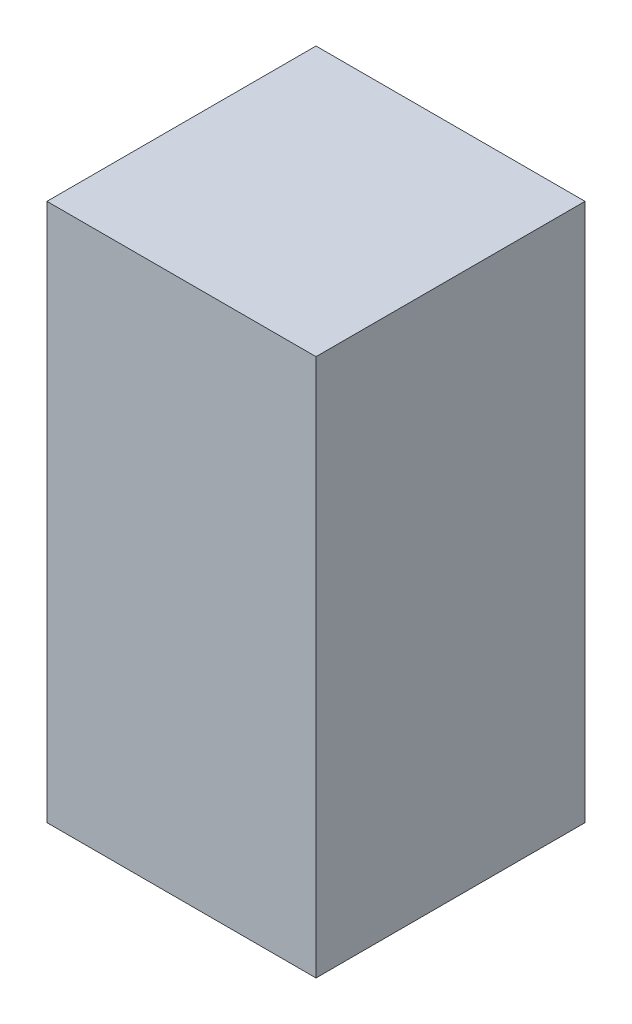
from build123d import *

# Parameters (mm, degrees)
SKETCH1_W           = 127
SKETCH1_H           = 127
BOSS_EXTRUDE1_DEPTH = 254


with BuildPart() as part:
    # Sketch1 → Boss-Extrude1 (new body)
    with BuildSketch(Plane(origin=(0, 0, 0), x_dir=(1, 0, 0), z_dir=(0, 1, 0))):
        Rectangle(SKETCH1_W, SKETCH1_H)
    extrude(amount=BOSS_EXTRUDE1_DEPTH)


solid = part.part
